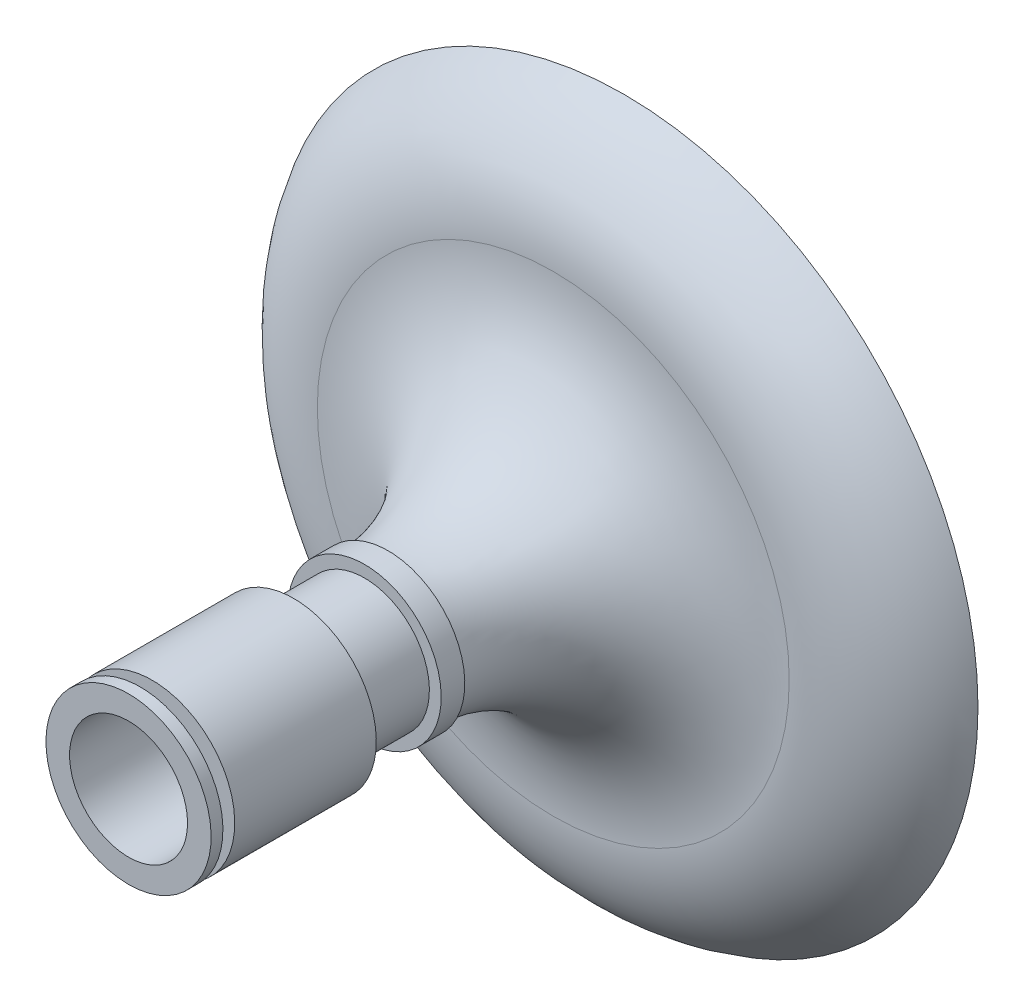
from build123d import *

# Parameters (mm, degrees)
SHELL1_T                = -1
CUT_EXTRUDE1_DEPTH      = 24.895606291
CUT_EXTRUDE1_DEPTH_BACK = 24.895606291
SKETCH3_R               = 2.5


with BuildPart() as part:
    # Sketch1 → Revolve1 (revolve)
    with BuildSketch(Plane.YZ):
        with BuildLine():
            Line((0, -10), (-15, -10))
            ThreePointArc((-15, -10), (-12.915475947, -7.807540088), (-10, -7))
            ThreePointArc((-10, -7), (-5.050252532, -4.949747468), (-3, 0))
            Line((-3, 0), (0, 0))
            Line((0, 0), (0, -10))
        make_face()
    revolve(axis=Axis((0, 0, 0), (0, 0, -1)))

    # Shell1
    shell1_openings = [part.faces().sort_by_distance(p)[0] for p in [
        (0, 0, -10),
    ]]
    offset(amount=SHELL1_T, openings=shell1_openings, kind=Kind.INTERSECTION)


with BuildPart() as body_2:
    # Sketch2 → Revolve2 (revolve)
    with BuildSketch(Plane.YZ):
        Polygon((0, 0), (-3.25, 0), (-3.25, 1), (-2.75, 1), (-2.75, 4), (-3.5, 4), (-3.5, 10), (-2.75, 10), (-2.75, 10.5), (-3.5, 10.5), (-3.5, 11), (0, 11), align=None)
    revolve(axis=Axis((0, 0, 11), (0, 0, -1)))


with BuildPart() as cut_extrude1_tool:
    # Sketch3 → Cut-Extrude1 (new, two sides: drawn at the far end of the back side and taken through both)
    with BuildSketch(Plane(origin=(0, 0, 0), x_dir=(0, 1, 0), z_dir=(0, 0, 1)).offset(-CUT_EXTRUDE1_DEPTH_BACK)):
        with Locations(Location((0, 0, 0), (0, 0, 270))):
            Circle(SKETCH3_R)
    extrude(amount=CUT_EXTRUDE1_DEPTH + CUT_EXTRUDE1_DEPTH_BACK)


with BuildPart() as part_1:
    add(part.part)

    # Cut-Extrude1: cut by cut_extrude1_tool
    add(cut_extrude1_tool.part, mode=Mode.SUBTRACT)


with BuildPart() as body_2_1:
    add(body_2.part)

    # Cut-Extrude1: cut by cut_extrude1_tool
    add(cut_extrude1_tool.part, mode=Mode.SUBTRACT)


solid = Compound([part_1.part, body_2_1.part])
